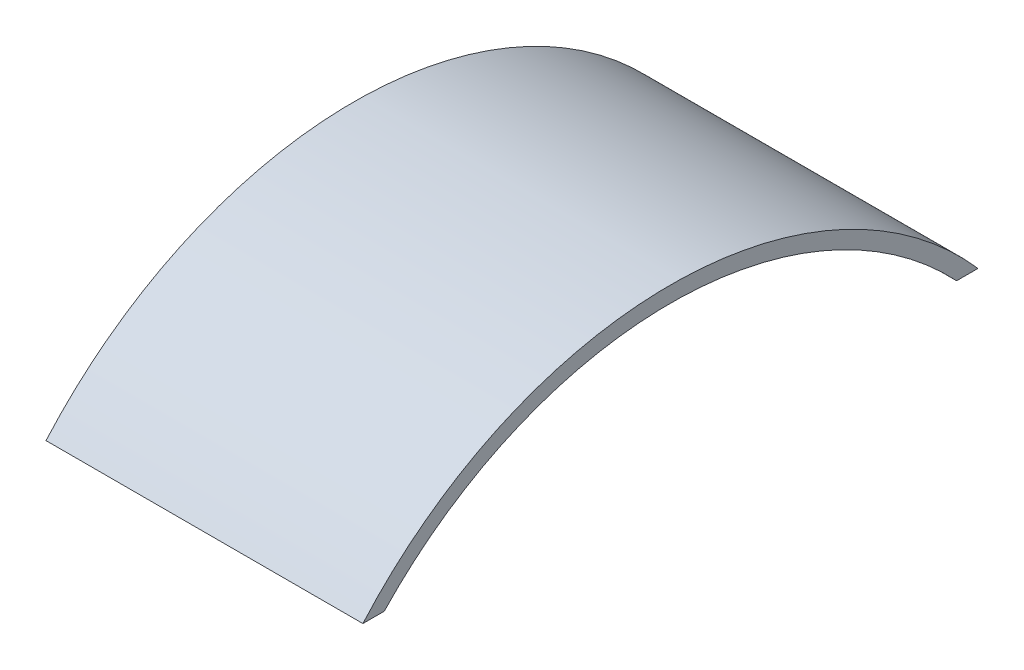
from build123d import *

# Parameters (mm, degrees)
BOSS_EXTRUDE1_DEPTH = 2


with BuildPart() as part:
    # Sketch1 → Boss-Extrude1 (new body)
    with BuildSketch(Plane(origin=(0, 0, 0), x_dir=(0, 0, -1), z_dir=(1, 0, 0))):
        with BuildLine():
            Line((-1.806029722, 1.7), (-1.941081534, 1.7))
            ThreePointArc((-1.941081534, 1.7), (0, 2.580270823), (1.941081534, 1.7))
            Line((1.941081534, 1.7), (1.806029722, 1.7))
            ThreePointArc((1.806029722, 1.7), (0, 2.480270823), (-1.806029722, 1.7))
        make_face()
    extrude(amount=BOSS_EXTRUDE1_DEPTH)


solid = part.part
